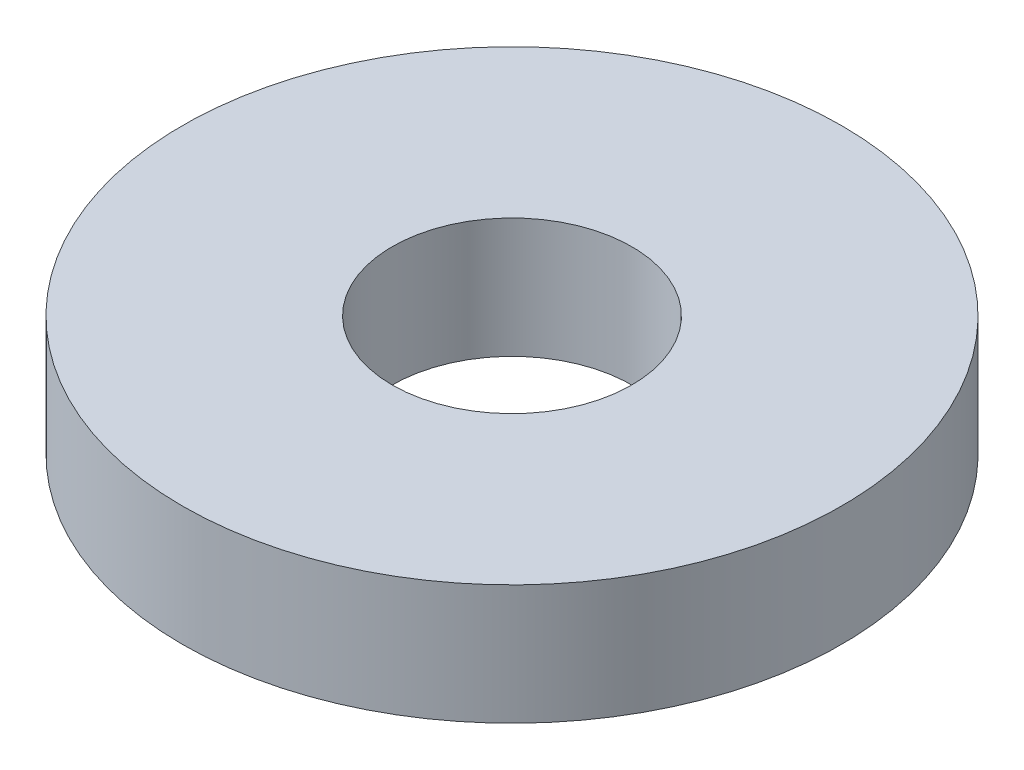
from build123d import *

# Parameters (mm, degrees)
CROQUIS1_R              = 11
CROQUIS1_R_2            = 4
SALIENTE_EXTRUIR1_DEPTH = 4


with BuildPart() as part:
    # Croquis1 → Saliente-Extruir1 (new body)
    with BuildSketch(Plane(origin=(0, 0, 0), x_dir=(1, 0, 0), z_dir=(0, 1, 0))):
        with Locations(Location((0, 0, 0), (0, 0, 270))):
            Circle(CROQUIS1_R)
        with Locations(Location((0, 0, 0), (0, 0, 270))):
            Circle(CROQUIS1_R_2, mode=Mode.SUBTRACT)
    extrude(amount=SALIENTE_EXTRUIR1_DEPTH)


solid = part.part
